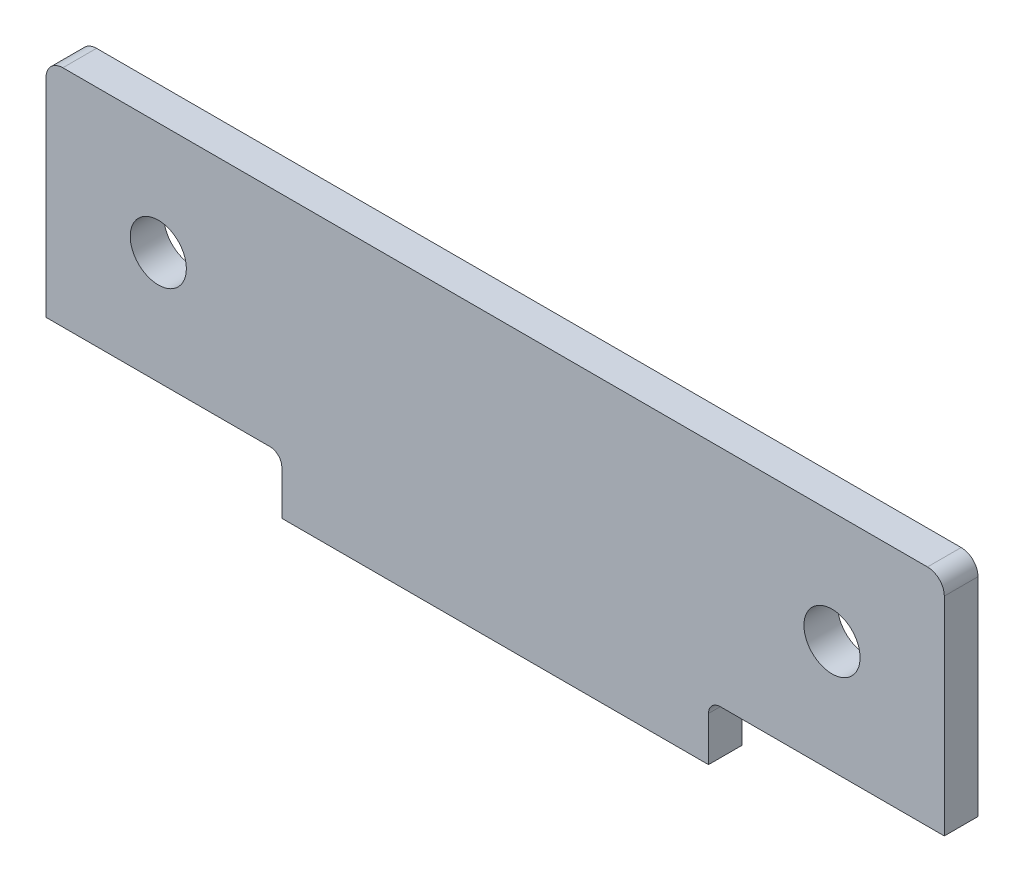
from build123d import *

# Parameters (mm, degrees)
SKETCH_1_R      = 2.5
EXTRUDE_1_DEPTH = 3
FILLET_1_R      = 1.05
FILLET_2_R      = 1.5


with BuildPart() as part:
    # ｽｹｯﾁ1 → ﾎﾞｽ - 押し出し1 (new body)
    with BuildSketch(Plane.XY):
        Polygon((-19, 0), (19, 0), (19, 5), (40, 5), (40, 25), (-40, 25), (-40, 5), (-19, 5), align=None)
        with Locations((-30, 15)):
            Circle(SKETCH_1_R, mode=Mode.SUBTRACT)
        with Locations(Location((30, 15, 0), (0, 0, 180))):
            Circle(SKETCH_1_R, mode=Mode.SUBTRACT)
    extrude(amount=EXTRUDE_1_DEPTH)

    # ﾌｨﾚｯﾄ1
    fillet_1_edges = [part.edges().sort_by_distance(p)[0] for p in [
        (-19, 5, 1.5),
        (19, 5, 1.5),
    ]]
    fillet(fillet_1_edges, radius=FILLET_1_R)

    # ﾌｨﾚｯﾄ2
    fillet_2_edges = [part.edges().sort_by_distance(p)[0] for p in [
        (-40, 25, 1.5),
        (40, 25, 1.5),
    ]]
    fillet(fillet_2_edges, radius=FILLET_2_R)


solid = part.part
